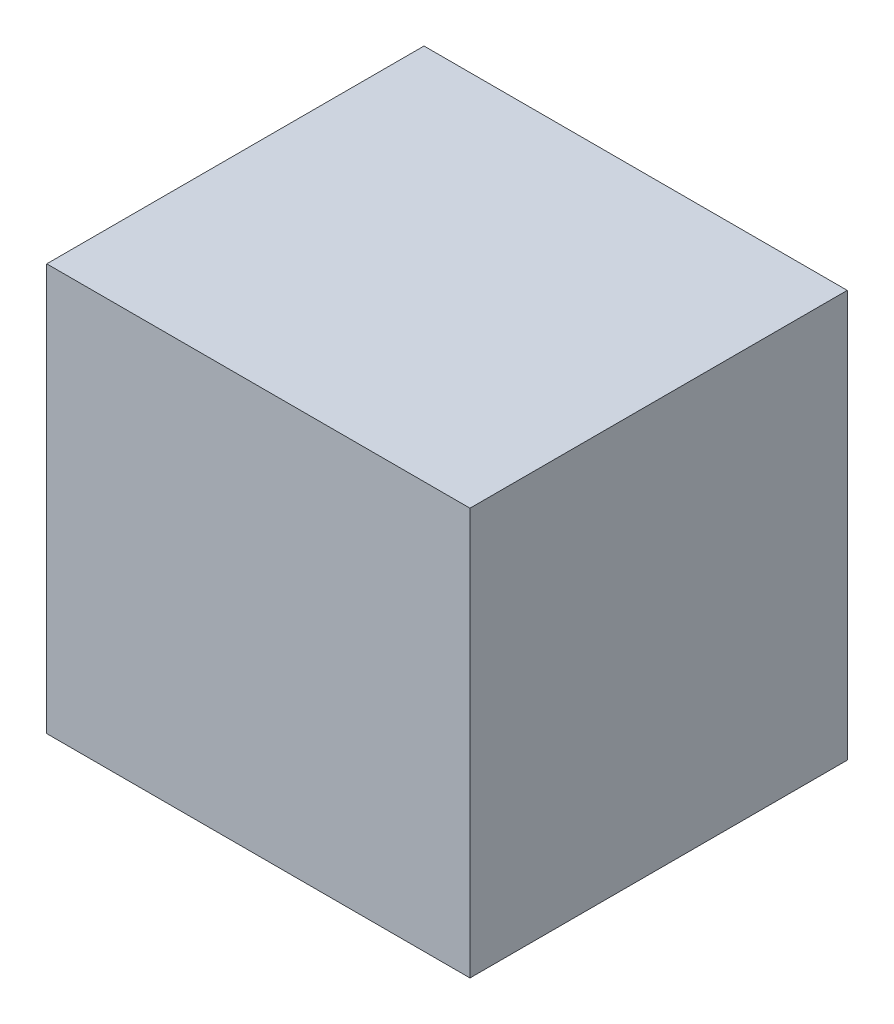
from build123d import *

# Parameters (mm, degrees)
SKETCH1_W           = 26.741691754
SKETCH1_H           = 28.839079344
BOSS_EXTRUDE1_DEPTH = 30
SCALE1_SCALE        = 3


with BuildPart() as part:
    # Sketch1 → Boss-Extrude1 (new body)
    with BuildSketch(Plane(origin=(0, 0, 0), x_dir=(0, 0, -1), z_dir=(1, 0, 0))):
        with Locations((11.797805186, 5.374555696)):
            Rectangle(SKETCH1_W, SKETCH1_H)
    extrude(amount=BOSS_EXTRUDE1_DEPTH)


with BuildPart() as part_1:
    # Scale1: scaled about (15, 5.374555696, -11.797805186)
    add(part.part.scale(SCALE1_SCALE).moved(Location((-30, -10.749111392, 23.595610372))))


solid = part_1.part
